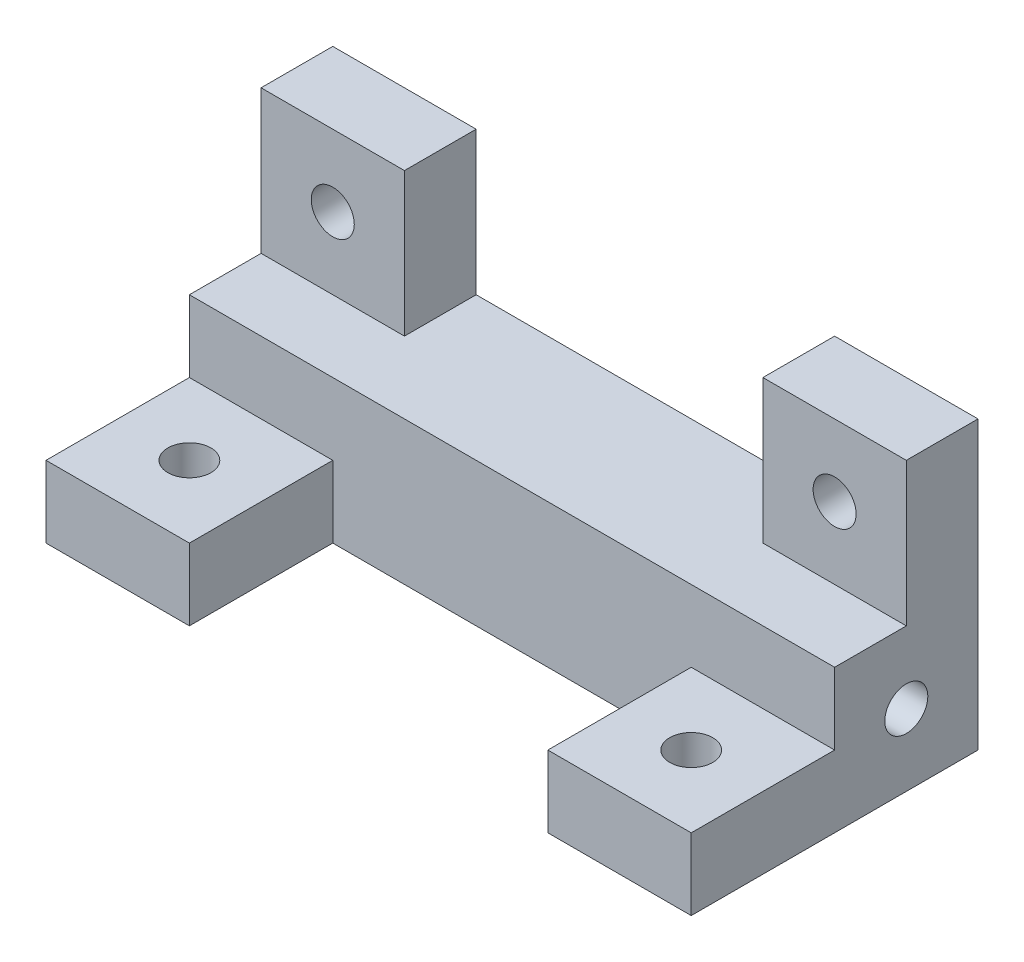
from build123d import *

# Parameters (mm, degrees)
SKETCH1_W           = 45
SKETCH1_H           = 10
BOSS_EXTRUDE1_DEPTH = 10
SKETCH2_W           = 10
SKETCH2_H           = 5
BOSS_EXTRUDE2_DEPTH = 10
SKETCH3_W           = 10
SKETCH3_H           = 5
BOSS_EXTRUDE3_DEPTH = 10
SKETCH4_R           = 1.5
CUT_EXTRUDE1_DEPTH  = 5
SKETCH5_R           = 1.5
CUT_EXTRUDE2_DEPTH  = 5
SKETCH6_R           = 1.5
CUT_EXTRUDE3_DEPTH  = 5
CUT_EXTRUDE4_START  = -5
SKETCH7_R           = 1.5
CUT_EXTRUDE4_DEPTH  = 5
SKETCH8_R           = 1.5
CUT_EXTRUDE5_DEPTH  = 5
SKETCH9_R           = 1.5
CUT_EXTRUDE6_DEPTH  = 5


with BuildPart() as part:
    # Sketch1 → Boss-Extrude1 (new body)
    with BuildSketch(Plane.XY):
        with Locations((22.5, 5)):
            Rectangle(SKETCH1_W, SKETCH1_H)
    extrude(amount=BOSS_EXTRUDE1_DEPTH)

    # Sketch2 → Boss-Extrude2 (add)
    with BuildSketch(Plane(origin=(0, 10, 0), x_dir=(1, 0, 0), z_dir=(0, 1, 0))):
        with Locations((5, -2.5)):
            Rectangle(SKETCH2_W, SKETCH2_H)
        with Locations((40, -2.5)):
            Rectangle(SKETCH2_W, SKETCH2_H)
    extrude(amount=BOSS_EXTRUDE2_DEPTH)

    # Sketch3 → Boss-Extrude3 (add)
    with BuildSketch(Plane.XY.offset(10)):
        with Locations((5, 2.5)):
            Rectangle(SKETCH3_W, SKETCH3_H)
        with Locations((40, 2.5)):
            Rectangle(SKETCH3_W, SKETCH3_H)
    extrude(amount=BOSS_EXTRUDE3_DEPTH)

    # Sketch4 → Cut-Extrude1 (cut)
    with BuildSketch(Plane.ZY):
        with Locations((5, 5)):
            Circle(SKETCH4_R)
    extrude(amount=-CUT_EXTRUDE1_DEPTH, mode=Mode.SUBTRACT)

    # Sketch5 → Cut-Extrude2 (cut)
    with BuildSketch(Plane.XY.offset(5)):
        with Locations((5, 15)):
            Circle(SKETCH5_R)
    extrude(amount=-CUT_EXTRUDE2_DEPTH, mode=Mode.SUBTRACT)

    # Sketch6 → Cut-Extrude3 (cut)
    with BuildSketch(Plane(origin=(0, 5, 0), x_dir=(1, 0, 0), z_dir=(0, 1, 0))):
        with Locations(Location((5, -15, 0), (0, 0, 270))):
            Circle(SKETCH6_R)
    extrude(amount=-CUT_EXTRUDE3_DEPTH, mode=Mode.SUBTRACT)

    # Sketch7 → Cut-Extrude4 (cut)
    with BuildSketch(Plane(origin=(45, 0, 0), x_dir=(0, 0, -1), z_dir=(1, 0, 0)).offset(CUT_EXTRUDE4_START)):
        with Locations(Location((-5, 5, 0), (0, 0, 180))):
            Circle(SKETCH7_R)
    extrude(amount=CUT_EXTRUDE4_DEPTH, mode=Mode.SUBTRACT)

    # Sketch8 → Cut-Extrude5 (cut)
    with BuildSketch(Plane.XY.offset(5)):
        with Locations((40, 15)):
            Circle(SKETCH8_R)
    extrude(amount=-CUT_EXTRUDE5_DEPTH, mode=Mode.SUBTRACT)

    # Sketch9 → Cut-Extrude6 (cut)
    with BuildSketch(Plane(origin=(0, 5, 0), x_dir=(1, 0, 0), z_dir=(0, 1, 0))):
        with Locations(Location((40, -15, 0), (0, 0, 180))):
            Circle(SKETCH9_R)
    extrude(amount=-CUT_EXTRUDE6_DEPTH, mode=Mode.SUBTRACT)


solid = part.part
